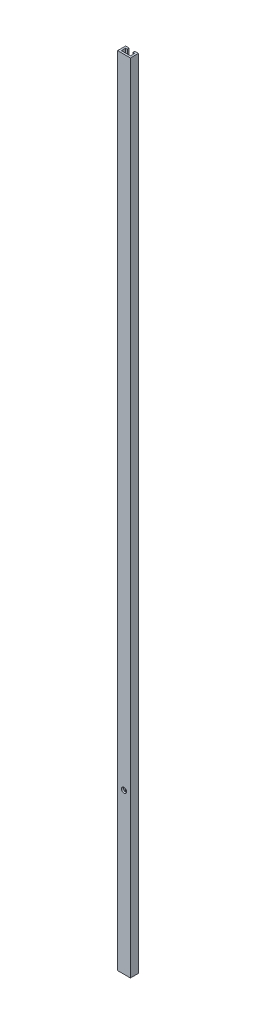
from build123d import *

# Parameters (mm, degrees)
EXTRUDE_1_DEPTH     = 500
SKETCH_2_R          = 1.6
CUT_EXTRUDE_1_DEPTH = 1.15


with BuildPart() as part:
    # 草图1 → 凸台-拉伸1 (new body)
    with BuildSketch(Plane(origin=(0, 0, 0), x_dir=(1, 0, 0), z_dir=(0, 1, 0))):
        Polygon((0, -5), (8, -5), (8, 0), (5.75, 0), (5.75, -1.15), (6.85, -1.15), (6.85, -3.85), (1.15, -3.85), (1.15, -1.15), (2.25, -1.15), (2.25, 0), (0, 0), align=None)
    extrude(amount=EXTRUDE_1_DEPTH)

    # 草图2 → 切除-拉伸1 (cut)
    with BuildSketch(Plane.XY.offset(5)):
        with Locations((4, 100)):
            Circle(SKETCH_2_R)
    extrude(amount=-CUT_EXTRUDE_1_DEPTH, mode=Mode.SUBTRACT)


solid = part.part
